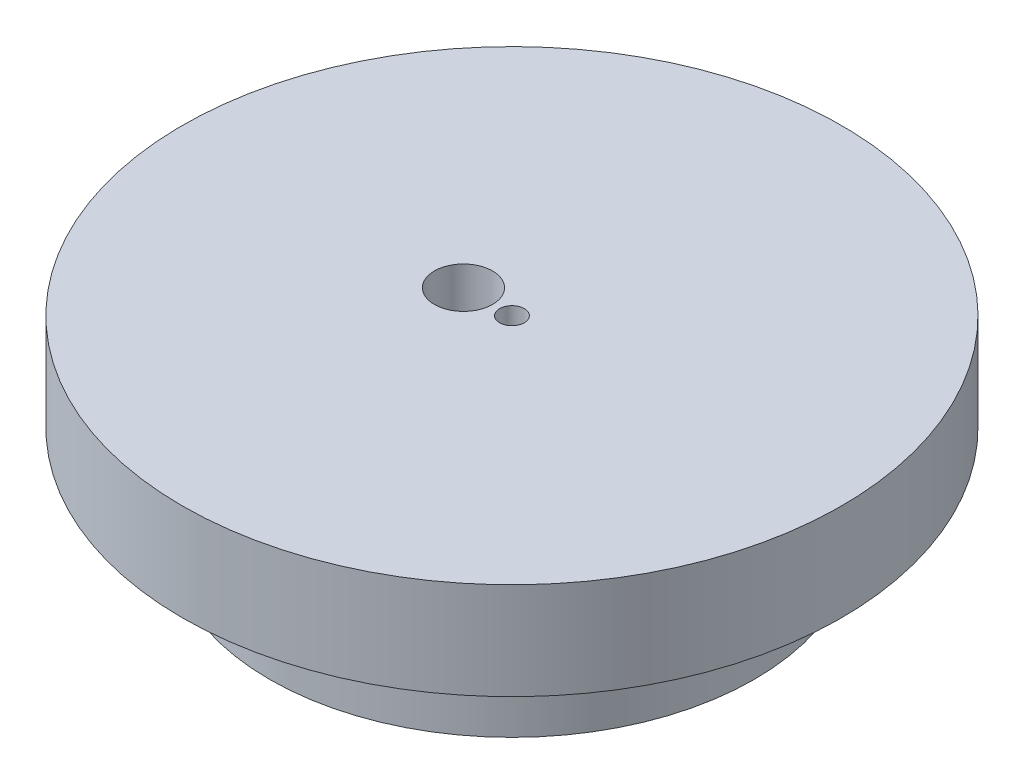
from build123d import *

# Parameters (mm, degrees)
SKETCH1_R           = 25
BOSS_EXTRUDE1_DEPTH = 10
SKETCH2_R           = 34
SKETCH2_R_2         = 1.27
BOSS_EXTRUDE2_DEPTH = 10
SKETCH3_R           = 3
CUT_EXTRUDE1_DEPTH  = 53.076866265
CUT_EXTRUDE2_DEPTH  = 2.5


with BuildPart() as part:
    # Sketch1 → Boss-Extrude1 (new body)
    with BuildSketch(Plane(origin=(0, 0, 0), x_dir=(1, 0, 0), z_dir=(0, 1, 0))):
        with Locations(Location((0, 0, 0), (0, 0, 270))):
            Circle(SKETCH1_R)
        with BuildLine():
            Line((-1.5, 11), (1.5, 11))
            Line((1.5, 11), (2.425924848, 8.146464793))
            ThreePointArc((2.425924848, 8.146464793), (3.252809175, 7.852976026), (4.045032587, 7.475808409))
            Line((4.045032587, 7.475808409), (6.717514421, 8.838834765))
            Line((6.717514421, 8.838834765), (8.838834765, 6.717514421))
            Line((8.838834765, 6.717514421), (7.475808409, 4.045032587))
            ThreePointArc((7.475808409, 4.045032587), (7.852976026, 3.252809175), (8.146464793, 2.425924848))
            Line((8.146464793, 2.425924848), (11, 1.5))
            Line((11, 1.5), (11, -1.5))
            Line((11, -1.5), (8.146464793, -2.425924848))
            ThreePointArc((8.146464793, -2.425924848), (7.852976026, -3.252809175), (7.475808409, -4.045032587))
            Line((7.475808409, -4.045032587), (8.838834765, -6.717514421))
            Line((8.838834765, -6.717514421), (6.717514421, -8.838834765))
            Line((6.717514421, -8.838834765), (4.045032587, -7.475808409))
            ThreePointArc((4.045032587, -7.475808409), (3.252809175, -7.852976026), (2.425924848, -8.146464793))
            Line((2.425924848, -8.146464793), (1.5, -11))
            Line((1.5, -11), (-1.5, -11))
            Line((-1.5, -11), (-2.425924848, -8.146464793))
            ThreePointArc((-2.425924848, -8.146464793), (-3.252809175, -7.852976026), (-4.045032587, -7.475808409))
            Line((-4.045032587, -7.475808409), (-6.717514421, -8.838834765))
            Line((-6.717514421, -8.838834765), (-8.838834765, -6.717514421))
            Line((-8.838834765, -6.717514421), (-7.475808409, -4.045032587))
            ThreePointArc((-7.475808409, -4.045032587), (-7.852976026, -3.252809175), (-8.146464793, -2.425924848))
            Line((-8.146464793, -2.425924848), (-11, -1.5))
            Line((-11, -1.5), (-11, 1.5))
            Line((-11, 1.5), (-8.146464793, 2.425924848))
            ThreePointArc((-8.146464793, 2.425924848), (-7.852976026, 3.252809175), (-7.475808409, 4.045032587))
            Line((-7.475808409, 4.045032587), (-8.838834765, 6.717514421))
            Line((-8.838834765, 6.717514421), (-6.717514421, 8.838834765))
            Line((-6.717514421, 8.838834765), (-4.045032587, 7.475808409))
            ThreePointArc((-4.045032587, 7.475808409), (-3.252809175, 7.852976026), (-2.425924848, 8.146464793))
            Line((-2.425924848, 8.146464793), (-1.5, 11))
        make_face(mode=Mode.SUBTRACT)
    extrude(amount=BOSS_EXTRUDE1_DEPTH)

    # Sketch2 → Boss-Extrude2 (add)
    with BuildSketch(Plane(origin=(0, 10, 0), x_dir=(1, 0, 0), z_dir=(0, 1, 0))):
        with Locations(Location((0, 0, 0), (0, 0, 270))):
            Circle(SKETCH2_R)
        with Locations(Location((0, 0, 0), (0, 0, 270))):
            Circle(SKETCH2_R_2, mode=Mode.SUBTRACT)
    extrude(amount=BOSS_EXTRUDE2_DEPTH)

    # Sketch3 → Cut-Extrude1 (cut, through all)
    with BuildSketch(Plane(origin=(0, 20, 0), x_dir=(1, 0, 0), z_dir=(0, 1, 0))):
        with Locations(Location((-5, 0, 0), (0, 0, 270))):
            Circle(SKETCH3_R)
    extrude(amount=-CUT_EXTRUDE1_DEPTH, mode=Mode.SUBTRACT)

    # Sketch4 → Cut-Extrude2 (cut)
    with BuildSketch(Plane(origin=(0, 0, 0), x_dir=(-1, 0, 0), z_dir=(0, -1, 0))):
        Polygon((-20.068660666, 1.384852309), (-19.421525249, 1.384852309), (-19.421525249, -2.115147691), (-19.735627813, -2.115147691), (-19.735627813, 1.02587795), (-20.274089352, 1.02587795), align=None)
        Polygon((-17.895884224, 1.384852309), (-15.74203807, 1.384852309), (-17.581781659, -2.20489128), (-17.853115794, -2.055552338), (-16.27348839, 1.02587795), (-17.895884224, 1.02587795), align=None)
    extrude(amount=-CUT_EXTRUDE2_DEPTH, mode=Mode.SUBTRACT)


solid = part.part
